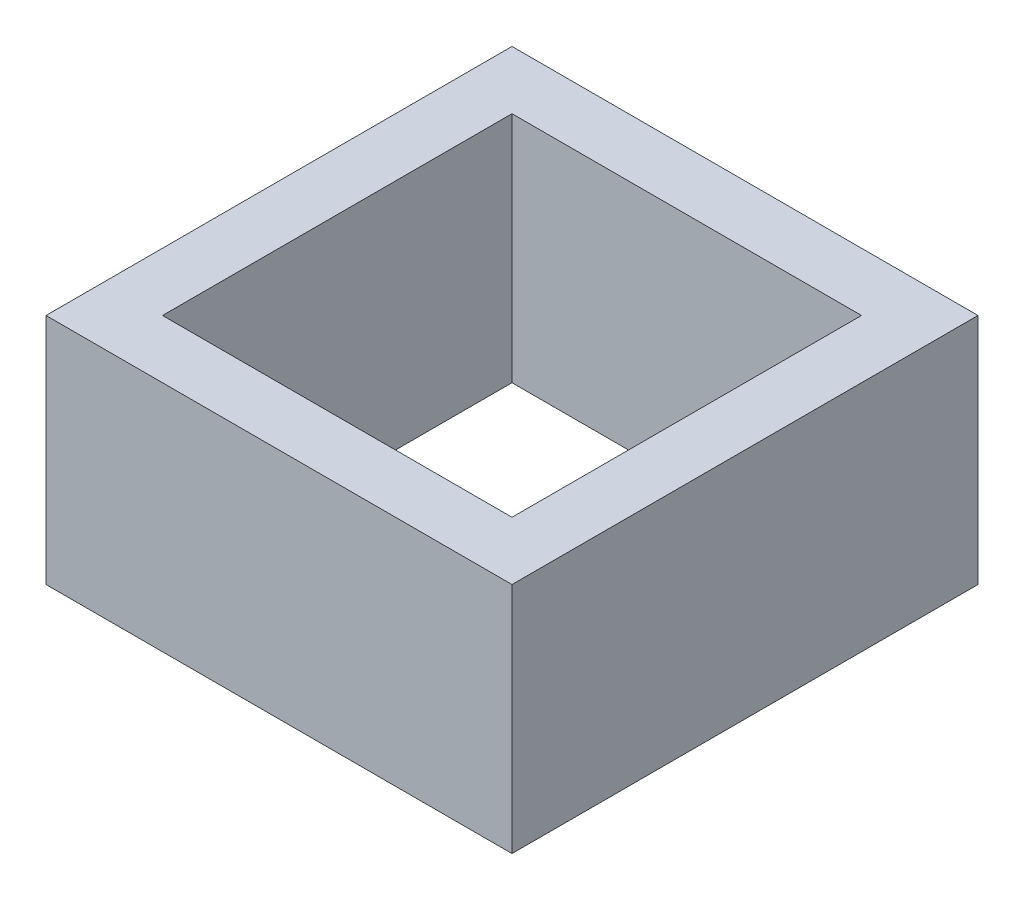
from build123d import *

# Parameters (mm, degrees)
SKETCH1_W           = 25.4
SKETCH1_H           = 25.4
SKETCH1_W_2         = 19.05
SKETCH1_H_2         = 19.05
EXTRUDE_THIN1_DEPTH = 12.7


with BuildPart() as part:
    # Sketch1 → Extrude-Thin1 (new body)
    with BuildSketch(Plane(origin=(0, 0, 0), x_dir=(1, 0, 0), z_dir=(0, 1, 0))):
        Rectangle(SKETCH1_W, SKETCH1_H)
        Rectangle(SKETCH1_W_2, SKETCH1_H_2, mode=Mode.SUBTRACT)
    extrude(amount=EXTRUDE_THIN1_DEPTH)


solid = part.part
